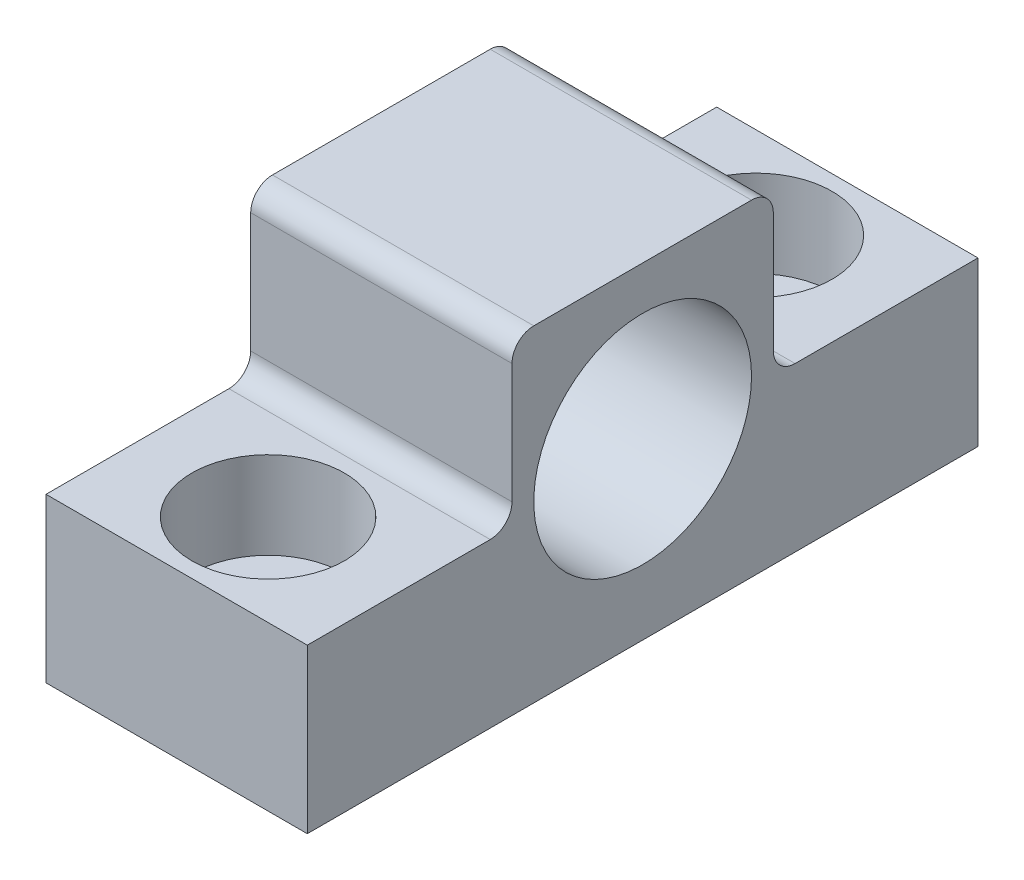
from build123d import *

# Parameters (mm, degrees)
BOSS_EXTRUDE1_DEPTH = 10
CUT_EXTRUDE1_REACH  = 29.981
SKETCH3_R           = 5
BOSS_EXTRUDE2_DEPTH = 2
FILLET1_R           = 1
CUT_EXTRUDE2_REACH  = 26.783
SKETCH5_R           = 2
SKETCH6_R           = 3.5
CUT_EXTRUDE3_DEPTH  = 4


with BuildPart() as part:
    # Sketch2 → Boss-Extrude1 (new body)
    with BuildSketch(Plane(origin=(0, 0, 0), x_dir=(0, 0, -1), z_dir=(1, 0, 0))):
        Polygon((0, 0), (12, 0), (12, -7.5), (21.4, -7.5), (21.4, -15), (-9.4, -15), (-9.4, -7.5), (0, -7.5), align=None)
    extrude(amount=BOSS_EXTRUDE1_DEPTH)

    # Sketch3 → Cut-Extrude1 (cut, up to next)
    with BuildSketch(Plane(origin=(10, 0, 0), x_dir=(0, 0, -1), z_dir=(1, 0, 0)), mode=Mode.PRIVATE) as cut_extrude1_sk1:
        with Locations((6, -7)):
            Circle(SKETCH3_R)
    cut_extrude1_tool1 = extrude(cut_extrude1_sk1.sketch, amount=-CUT_EXTRUDE1_REACH, mode=Mode.PRIVATE) & part.part
    add(cut_extrude1_tool1.solids().sort_by_distance((10, -7, -6))[0], mode=Mode.SUBTRACT)

    # Sketch4 → Boss-Extrude2 (add)
    with BuildSketch(Plane.ZY):
        Polygon((0, -7.5), (0, 0), (-12, 0), (-12, -7.5), (-21.4, -7.5), (-21.4, -15), (9.4, -15), (9.4, -7.5), align=None)
    extrude(amount=BOSS_EXTRUDE2_DEPTH)

    # Fillet1
    fillet1_edges = [part.edges().sort_by_distance(p)[0] for p in [
        (4, 0, 0),
        (4, 0, -12),
        (4, -7.5, -12),
        (4, -7.5, 0),
    ]]
    fillet(fillet1_edges, radius=FILLET1_R)

    # Sketch5 → Cut-Extrude2 (cut, up to next)
    with BuildSketch(Plane(origin=(0, -7.5, 0), x_dir=(1, 0, 0), z_dir=(0, 1, 0)), mode=Mode.PRIVATE) as cut_extrude2_sk1:
        with Locations(Location((4, 17.2, 0), (0, 0, 270))):
            Circle(SKETCH5_R)
    cut_extrude2_tool1 = extrude(cut_extrude2_sk1.sketch, amount=-CUT_EXTRUDE2_REACH, mode=Mode.PRIVATE) & part.part
    # Sketch5 → Cut-Extrude2 (cut, up to next)
    with BuildSketch(Plane(origin=(0, -7.5, 0), x_dir=(1, 0, 0), z_dir=(0, 1, 0)), mode=Mode.PRIVATE) as cut_extrude2_sk2:
        with Locations(Location((4, -5.2, 0), (0, 0, 270))):
            Circle(SKETCH5_R)
    cut_extrude2_tool2 = extrude(cut_extrude2_sk2.sketch, amount=-CUT_EXTRUDE2_REACH, mode=Mode.PRIVATE) & part.part
    add(cut_extrude2_tool1.solids().sort_by_distance((4, -7.5, -17.2))[0], mode=Mode.SUBTRACT)
    add(cut_extrude2_tool2.solids().sort_by_distance((4, -7.5, 5.2))[0], mode=Mode.SUBTRACT)

    # Sketch6 → Cut-Extrude3 (cut)
    with BuildSketch(Plane(origin=(0, -7.5, 0), x_dir=(1, 0, 0), z_dir=(0, 1, 0))):
        with Locations(Location((4, -5.2, 0), (0, 0, 270))):
            Circle(SKETCH6_R)
        with Locations(Location((4, 17.2, 0), (0, 0, 270))):
            Circle(SKETCH6_R)
    extrude(amount=-CUT_EXTRUDE3_DEPTH, mode=Mode.SUBTRACT)


solid = part.part
